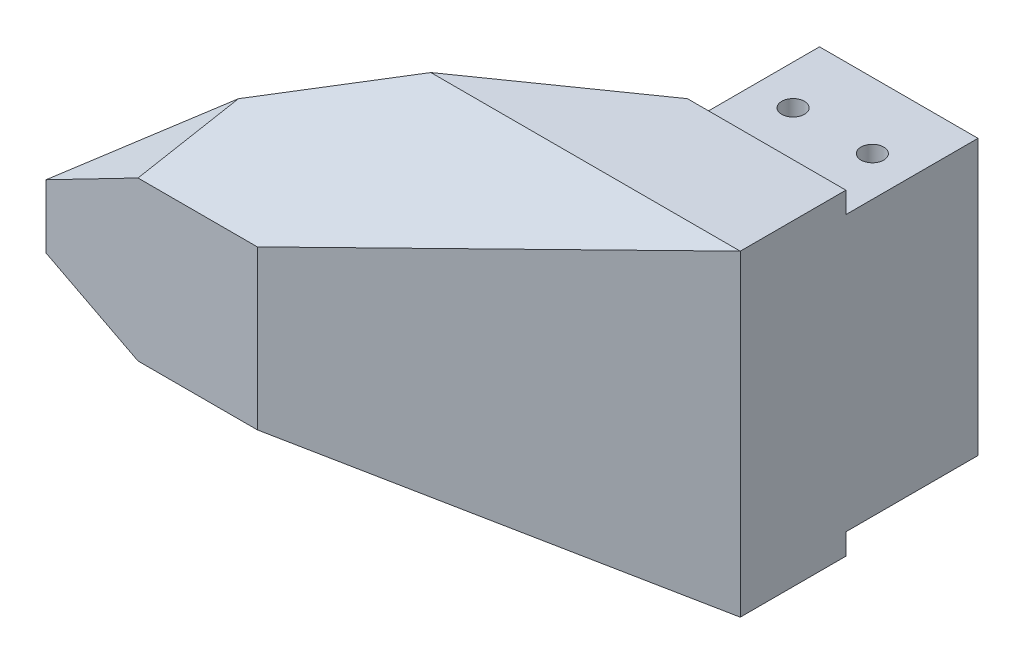
from build123d import *

# Parameters (mm, degrees)
EXTRUDE_1_DEPTH     = 30
EXTRUDE_2_DEPTH     = 101.4074
CUT_EXTRUDE_2_DEPTH = 140.67269183
CUT_EXTRUDE_3_DEPTH = 134.91587226
SKETCH_10_W         = 30
SKETCH_10_H         = 25
CUT_EXTRUDE_6_DEPTH = 4
SKETCH_11_W         = 30
SKETCH_11_H         = 25
CUT_EXTRUDE_7_DEPTH = 4
SKETCH_13_R         = 2.15
CUT_EXTRUDE_8_DEPTH = 139.001669711
SKETCH_14_R         = 5
CUT_EXTRUDE_9_DEPTH = 40


with BuildPart() as part:
    # 草图2 → 凸台-拉伸1 (new body)
    with BuildSketch(Plane(origin=(0, 0, 0), x_dir=(1, 0, 0), z_dir=(0, 1, 0))):
        Polygon((0, 0), (71.407400337, 50), (71.407400337, 75), (101.407400337, 75), (101.407400337, 30), (40, 0), align=None)
    extrude(amount=EXTRUDE_1_DEPTH)

    # 草图4 → 凸台-拉伸2 (add, through all)
    with BuildSketch(Plane(origin=(101.407400337, 0, 0), x_dir=(0, 0, -1), z_dir=(1, 0, 0))):
        Polygon((0, 30), (30, 45), (75, 45), (75, 30), align=None)
        Polygon((0, 0), (75, 0), (75, -15), (30, -15), align=None)
    extrude(amount=-EXTRUDE_2_DEPTH)

    # 草图5 → 切除-拉伸2 (cut, through all)
    with BuildSketch(Plane.XZ.offset(15)):
        Polygon((40, 0), (101.407400337, 0), (101.407400337, -30), align=None)
        Polygon((0, 0), (0, -75), (71.407400337, -75), (71.407400337, -50), align=None)
    extrude(amount=-CUT_EXTRUDE_2_DEPTH, mode=Mode.SUBTRACT)

    # 草图6 → 切除-拉伸3 (cut, through all)
    with BuildSketch(Plane(origin=(0, 0, 0), x_dir=(-0.8191520442889949, 0, 0.5735764363510418), z_dir=(-0.5735764363510418, 0, -0.8191520442889949))):
        Polygon((0, 21), (-26.151701934, 37.5), (0, 30), align=None)
        Polygon((0, 0), (-26.151701934, -7.5), (0, 9), align=None)
    extrude(amount=-CUT_EXTRUDE_3_DEPTH, mode=Mode.SUBTRACT)

    # 草图10 → 切除-拉伸6 (cut)
    with BuildSketch(Plane.XZ.offset(15)):
        with Locations((86.407400337, -62.5)):
            Rectangle(SKETCH_10_W, SKETCH_10_H)
    extrude(amount=-CUT_EXTRUDE_6_DEPTH, mode=Mode.SUBTRACT)

    # 草图11 → 切除-拉伸7 (cut)
    with BuildSketch(Plane(origin=(0, 45, 0), x_dir=(1, 0, 0), z_dir=(0, 1, 0))):
        with Locations((86.407400337, 62.5)):
            Rectangle(SKETCH_11_W, SKETCH_11_H)
    extrude(amount=-CUT_EXTRUDE_7_DEPTH, mode=Mode.SUBTRACT)

    # 草图13 → 切除-拉伸8 (cut, through all)
    with BuildSketch(Plane(origin=(0, 41, 0), x_dir=(1, 0, 0), z_dir=(0, 1, 0))):
        with Locations(Location((78.907400337, 62.5, 0), (0, 0, 270))):
            Circle(SKETCH_13_R)
        with Locations(Location((93.907400337, 62.5, 0), (0, 0, 270))):
            Circle(SKETCH_13_R)
    extrude(amount=-CUT_EXTRUDE_8_DEPTH, mode=Mode.SUBTRACT)

    # 草图14 → 切除-拉伸9 (cut)
    with BuildSketch(Plane(origin=(0, 0, -75), x_dir=(-1, 0, 0), z_dir=(0, 0, -1))):
        with Locations((-86.407400337, 15)):
            Circle(SKETCH_14_R)
    extrude(amount=-CUT_EXTRUDE_9_DEPTH, mode=Mode.SUBTRACT)


solid = part.part
